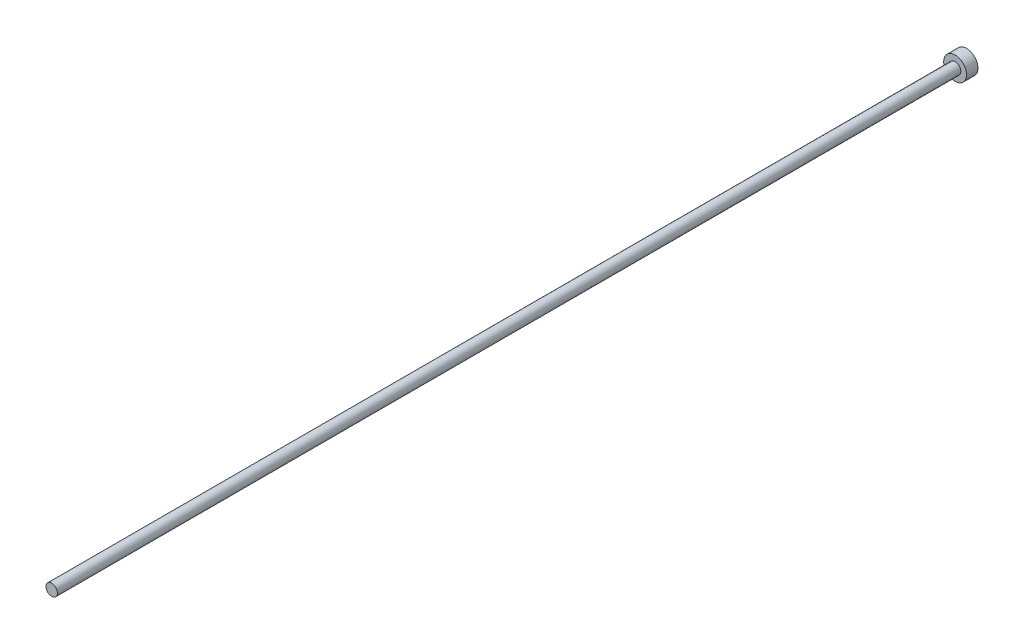
from build123d import *


with BuildPart() as part:
    # Sketch2 → Revolve1 (revolve)
    with BuildSketch(Plane(origin=(0, 0, 0), x_dir=(0, 0, -1), z_dir=(1, 0, 0)), mode=Mode.PRIVATE) as revolve1_sk:
        Polygon((80, 0), (80, 2), (78, 2), (78, 1), (-80, 1), (-80, 0), align=None)
    revolve(revolve1_sk.sketch.rotate(Axis((0, 0, 80), (0, 0, -1)), 90), axis=Axis((0, 0, 80), (0, 0, -1)))


solid = part.part
